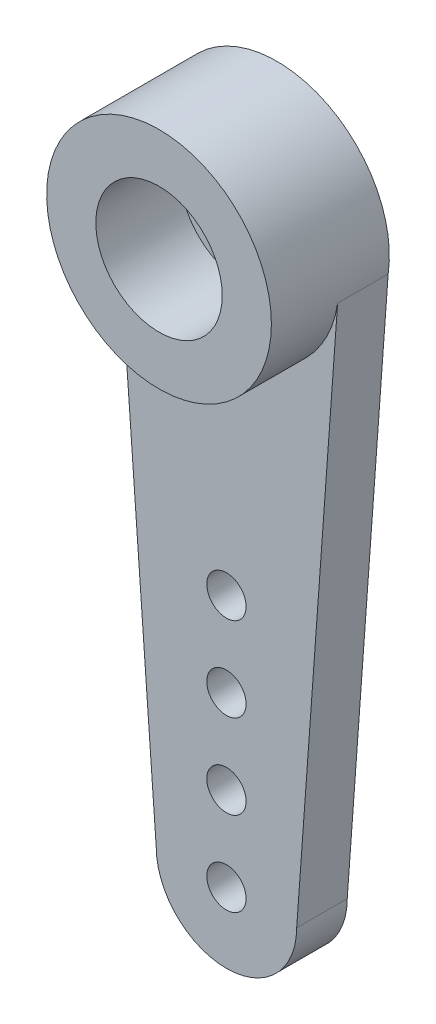
from build123d import *

# Parameters (mm, degrees)
ESBO_O1_R                = 4
ESBO_O1_R_2              = 2.25
RESSALTO_EXTRUS_O1_DEPTH = 4.2
ESBO_O3_R                = 0.7
RESSALTO_EXTRUS_O2_DEPTH = 1.8
ESBO_O4_R                = 2.5
RESSALTO_EXTRUS_O3_DEPTH = 1.2


with BuildPart() as part:
    # Esboço1 → Ressalto-extrusão1 (new body)
    with BuildSketch(Plane.XY):
        Circle(ESBO_O1_R)
        Circle(ESBO_O1_R_2, mode=Mode.SUBTRACT)
    extrude(amount=RESSALTO_EXTRUS_O1_DEPTH)

    # Esboço3 → Ressalto-extrusão2 (add)
    with BuildSketch(Plane.XY):
        with BuildLine():
            ThreePointArc((-2.5, -20.565998313), (0, -23.065998313), (2.5, -20.565998313))
            Line((2.5, -20.565998313), (3.957668004, -0.580399834))
            ThreePointArc((3.957668004, -0.580399834), (0, -4), (-3.957668004, -0.580399834))
            Line((-3.957668004, -0.580399834), (-2.5, -20.565998313))
        make_face()
        with Locations((0, -20.565998313)):
            Circle(ESBO_O3_R, mode=Mode.SUBTRACT)
        with Locations((0, -17.565998313)):
            Circle(ESBO_O3_R, mode=Mode.SUBTRACT)
        with Locations((0, -14.565998313)):
            Circle(ESBO_O3_R, mode=Mode.SUBTRACT)
        with Locations((0, -11.565998313)):
            Circle(ESBO_O3_R, mode=Mode.SUBTRACT)
    extrude(amount=RESSALTO_EXTRUS_O2_DEPTH)

    # Esboço4 → Ressalto-extrusão3 (add)
    with BuildSketch(Plane.XY):
        Circle(ESBO_O4_R)
    extrude(amount=RESSALTO_EXTRUS_O3_DEPTH)


solid = part.part
